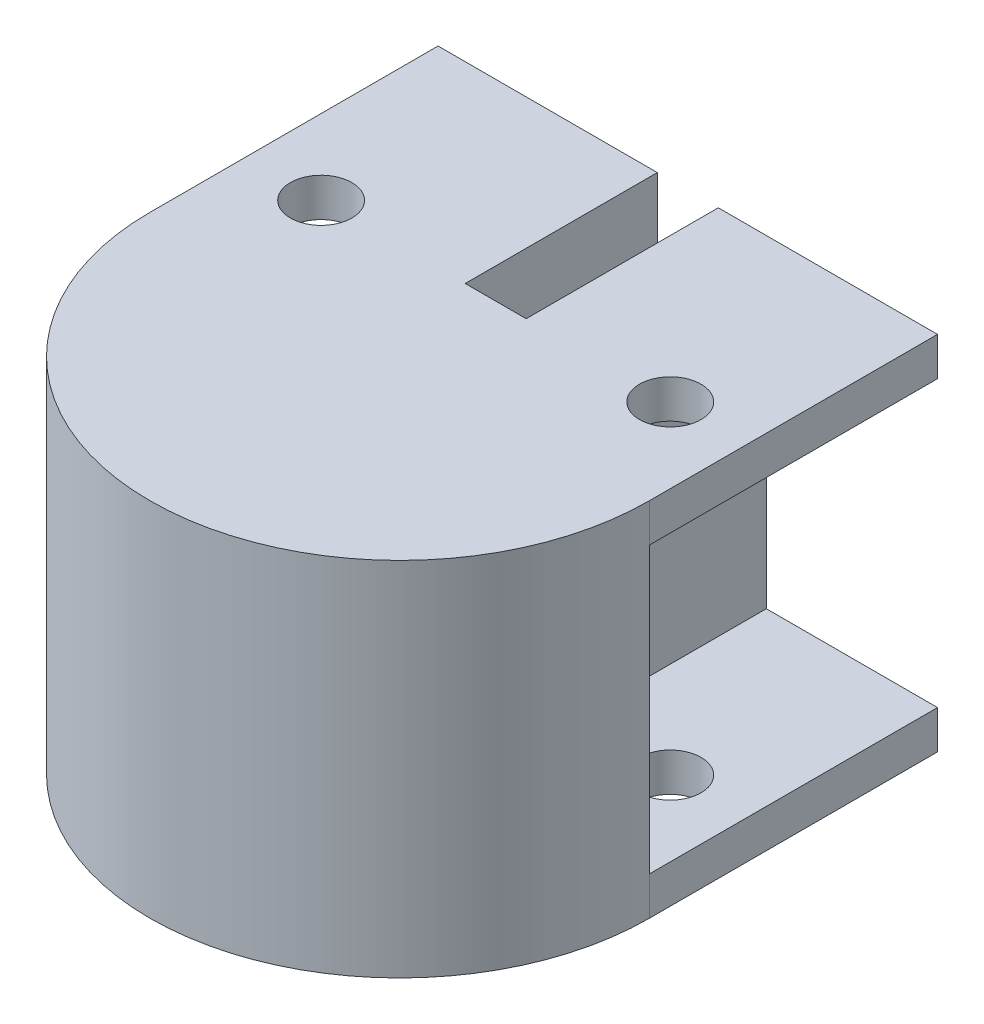
from build123d import *

# Parameters (mm, degrees)
SKETCH1_R           = 1.6
BOSS_EXTRUDE1_DEPTH = 2
BOSS_EXTRUDE3_START = 7.4125
BOSS_EXTRUDE3_DEPTH = 7.4125


with BuildPart() as part:
    # Sketch1 → Boss-Extrude1 (new body)
    with BuildSketch(Plane(origin=(0, 0, 0), x_dir=(1, 0, 0), z_dir=(0, 1, 0))):
        with BuildLine():
            Line((-1.5875, 0), (1.5875, 0))
            Line((1.5875, 0), (1.5875, 10))
            Line((1.5875, 10), (13, 10))
            Line((13, 10), (13, -5))
            ThreePointArc((13, -5), (0, -18), (-13, -5))
            Line((-13, -5), (-13, 10))
            Line((-13, 10), (-1.5875, 10))
            Line((-1.5875, 10), (-1.5875, 0))
        make_face()
        with Locations(Location((9.0875, 0, 0), (0, 0, 270))):
            Circle(SKETCH1_R, mode=Mode.SUBTRACT)
        with Locations(Location((-9.0875, 0, 0), (0, 0, 90))):
            Circle(SKETCH1_R, mode=Mode.SUBTRACT)
    boss_extrude1 = extrude(amount=BOSS_EXTRUDE1_DEPTH)

    # Sketch3 → Boss-Extrude3 (add)
    with BuildSketch(Plane.XZ.offset(BOSS_EXTRUDE3_START)):
        with BuildLine():
            Line((4.0875, -10), (1.5875, -10))
            Line((1.5875, -10), (1.5875, 0))
            Line((1.5875, 0), (-1.5875, 0))
            Line((-1.5875, 0), (-1.5875, -10))
            Line((-1.5875, -10), (-4.0875, -10))
            Line((-4.0875, -10), (-4.0875, 5))
            Line((-4.0875, 5), (-13, 5))
            ThreePointArc((-13, 5), (0, 18), (13, 5))
            Line((13, 5), (4.0875, 5))
            Line((4.0875, 5), (4.0875, -10))
        make_face()
    boss_extrude3 = extrude(amount=-BOSS_EXTRUDE3_DEPTH)

    # Mirror11: Boss-Extrude3 across plane
    add(boss_extrude3.mirror(Plane(origin=(0, -7.4125, 0), x_dir=(0, 0, 1), z_dir=(0, -1, 0))))

    # Mirror12: Boss-Extrude1 across plane
    add(boss_extrude1.mirror(Plane(origin=(0, -7.4125, 0), x_dir=(0, 0, 1), z_dir=(0, -1, 0))))


solid = part.part
